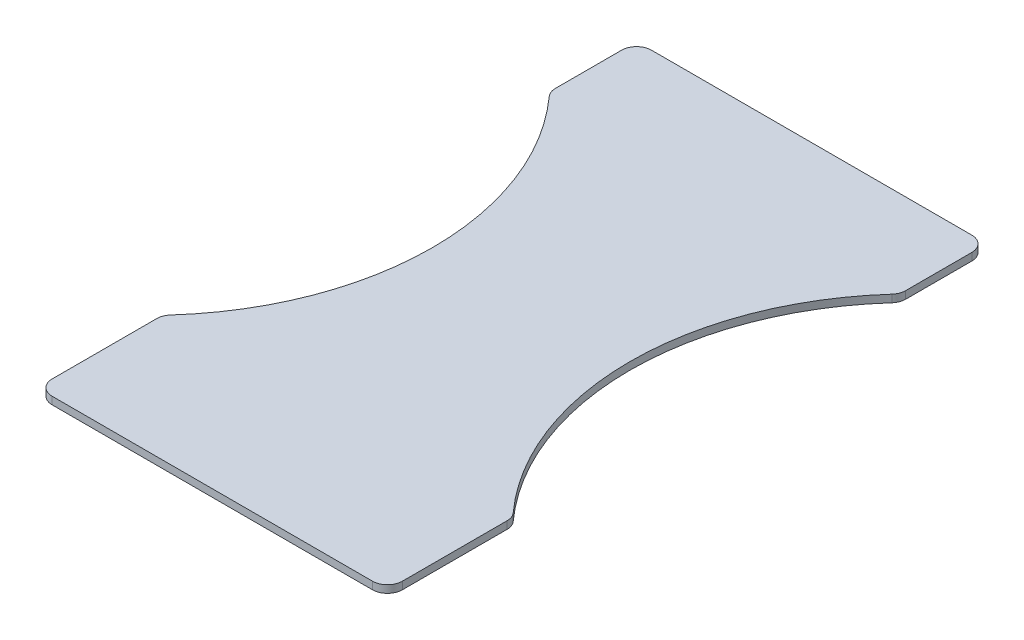
from build123d import *

# Parameters (mm, degrees)
BOSS_EXTRUDE1_DEPTH = 2.54
FILLET3_R           = 5.08
FILLET4_R           = 5.08
FILLET5_R           = 5.08
FILLET6_R           = 5.08
FILLET7_R           = 5.08
FILLET8_R           = 5.08
FILLET9_R           = 5.08
FILLET10_R          = 5.08


with BuildPart() as part:
    # Sketch2 → Boss-Extrude1 (new body)
    with BuildSketch(Plane(origin=(0, 0, 0), x_dir=(1, 0, 0), z_dir=(0, 1, 0))):
        with BuildLine():
            Line((-59.3725, 122.102714319), (-59.3725, 151.584711055))
            Line((-59.3725, 151.584711055), (59.3725, 151.584711055))
            Line((59.3725, 151.584711055), (59.3725, 122.102714319))
            ThreePointArc((59.3725, 122.102714319), (33.4645, 56.499868893), (59.3725, -9.102976533))
            Line((59.3725, -9.102976533), (59.3725, -51.615288945))
            Line((59.3725, -51.615288945), (-59.3725, -51.615288945))
            Line((-59.3725, -51.615288945), (-59.3725, -9.102976533))
            ThreePointArc((-59.3725, -9.102976533), (-33.4645, 56.499868893), (-59.3725, 122.102714319))
        make_face()
    extrude(amount=BOSS_EXTRUDE1_DEPTH)

    # Fillet3
    fillet3_edges = [part.edges().sort_by_distance(p)[0] for p in [
        (-59.3725, 1.27, -151.584711055),
    ]]
    fillet(fillet3_edges, radius=FILLET3_R)

    # Fillet4
    fillet4_edges = [part.edges().sort_by_distance(p)[0] for p in [
        (59.3725, 1.27, -151.584711055),
    ]]
    fillet(fillet4_edges, radius=FILLET4_R)

    # Fillet5
    fillet5_edges = [part.edges().sort_by_distance(p)[0] for p in [
        (-59.3725, 1.27, -122.102714319),
    ]]
    fillet(fillet5_edges, radius=FILLET5_R)

    # Fillet6
    fillet6_edges = [part.edges().sort_by_distance(p)[0] for p in [
        (59.3725, 1.27, -122.102714319),
    ]]
    fillet(fillet6_edges, radius=FILLET6_R)

    # Fillet7
    fillet7_edges = [part.edges().sort_by_distance(p)[0] for p in [
        (-59.3725, 1.27, 9.102976533),
    ]]
    fillet(fillet7_edges, radius=FILLET7_R)

    # Fillet8
    fillet8_edges = [part.edges().sort_by_distance(p)[0] for p in [
        (59.3725, 1.27, 9.102976533),
    ]]
    fillet(fillet8_edges, radius=FILLET8_R)

    # Fillet9
    fillet9_edges = [part.edges().sort_by_distance(p)[0] for p in [
        (59.3725, 1.27, 51.615288945),
    ]]
    fillet(fillet9_edges, radius=FILLET9_R)

    # Fillet10
    fillet10_edges = [part.edges().sort_by_distance(p)[0] for p in [
        (-59.3725, 1.27, 51.615288945),
    ]]
    fillet(fillet10_edges, radius=FILLET10_R)


solid = part.part
